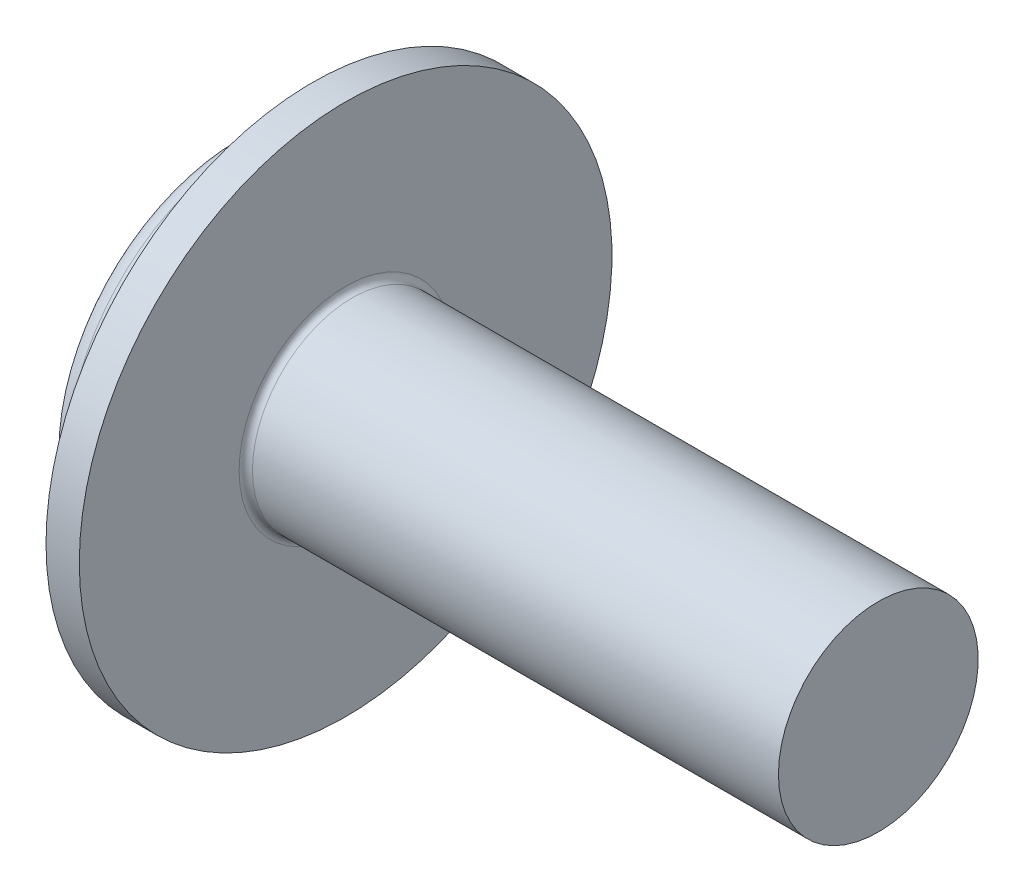
from build123d import *

# Parameters (mm, degrees)
FILLET1_R    = 0.1
RECPAT_COUNT = 2
RECPAT_ANGLE = 90
SCHIZZO1_W   = 0.5
SCHIZZO1_H   = 4


with BuildPart() as part:
    # BodySke → Base-Revolve (revolve)
    with BuildSketch(Plane.XY, mode=Mode.PRIVATE) as base_revolve_sk:
        with BuildLine():
            Line((2.4, 1.5), (2.4, 2.8))
            Line((2.4, 2.8), (1.003501533, 2.8))
            ThreePointArc((1.003501533, 2.8), (0.873295971, 2.76653015), (0.775371599, 2.674418605))
            ThreePointArc((0.775371599, 2.674418605), (0.197753546, 1.392274756), (0, 0))
            Line((0, 0), (10.4, 0))
            Line((10.4, 0), (10.4, 1.5))
            Line((10.4, 1.5), (2.4, 1.5))
        make_face()
    revolve(base_revolve_sk.sketch.rotate(Axis((1.003501533, 0, 0), (1, 0, 0)), 90), axis=Axis((1.003501533, 0, 0), (1, 0, 0)))

    # Fillet1
    fillet1_edges = [part.edges().sort_by_distance(p)[0] for p in [
        (2.4, 0, -1.5),
    ]]
    fillet(fillet1_edges, radius=FILLET1_R)

    # Sketch3 → Recess section 0
    with BuildSketch(Plane(origin=(0, 0, 0), x_dir=(0, 0, -1), z_dir=(1, 0, 0))):
        with BuildLine():
            Line((0.37, -1.4), (-0.37, -1.4))
            Line((-0.37, -1.4), (-0.37, 1.4))
            Line((-0.37, 1.4), (0.37, 1.4))
            Line((0.37, 1.4), (0.37, -1.4))
        make_face()
    # Sketch4 → Recess section 1
    with BuildSketch(Plane(origin=(1.75, 0, 0), x_dir=(0, 0, -1), z_dir=(1, 0, 0))):
        with BuildLine():
            Line((0.37, -0.527482332), (-0.37, -0.527482332))
            Line((-0.37, -0.527482332), (-0.37, 0.527482332))
            Line((-0.37, 0.527482332), (0.37, 0.527482332))
            Line((0.37, 0.527482332), (0.37, -0.527482332))
        make_face()
    recess = loft(mode=Mode.SUBTRACT)

    # RecPat: Recess ×2 about axis
    recpat_axis = Axis((0, 0, 0), (1, 0, 0))
    for i in range(1, RECPAT_COUNT):
        add(recess.rotate(recpat_axis, i * RECPAT_ANGLE / (RECPAT_COUNT - 1)), mode=Mode.SUBTRACT)

    # RecCorSke → RecessCore (revolve, cut)
    with BuildSketch(Plane.XY, mode=Mode.PRIVATE) as recesscore_sk:
        Polygon((0, 0), (0, 0.678371921), (1.75, 0.556), (1.930655351, 0), align=None)
    revolve(recesscore_sk.sketch.rotate(Axis((-3.175, 0, 0), (1, 0, 0)), 15.814025638), axis=Axis((-3.175, 0, 0), (1, 0, 0)), mode=Mode.SUBTRACT)

    # Schizzo1 → Rivoluzione2 (revolve)
    with BuildSketch(Plane(origin=(0, 0, 0), x_dir=(1, 0, 0), z_dir=(0, 1, 0))):
        with Locations((2.15, -2)):
            Rectangle(SCHIZZO1_W, SCHIZZO1_H)
    revolve(axis=Axis((0, 0, 0), (1, 0, 0)))


solid = part.part
